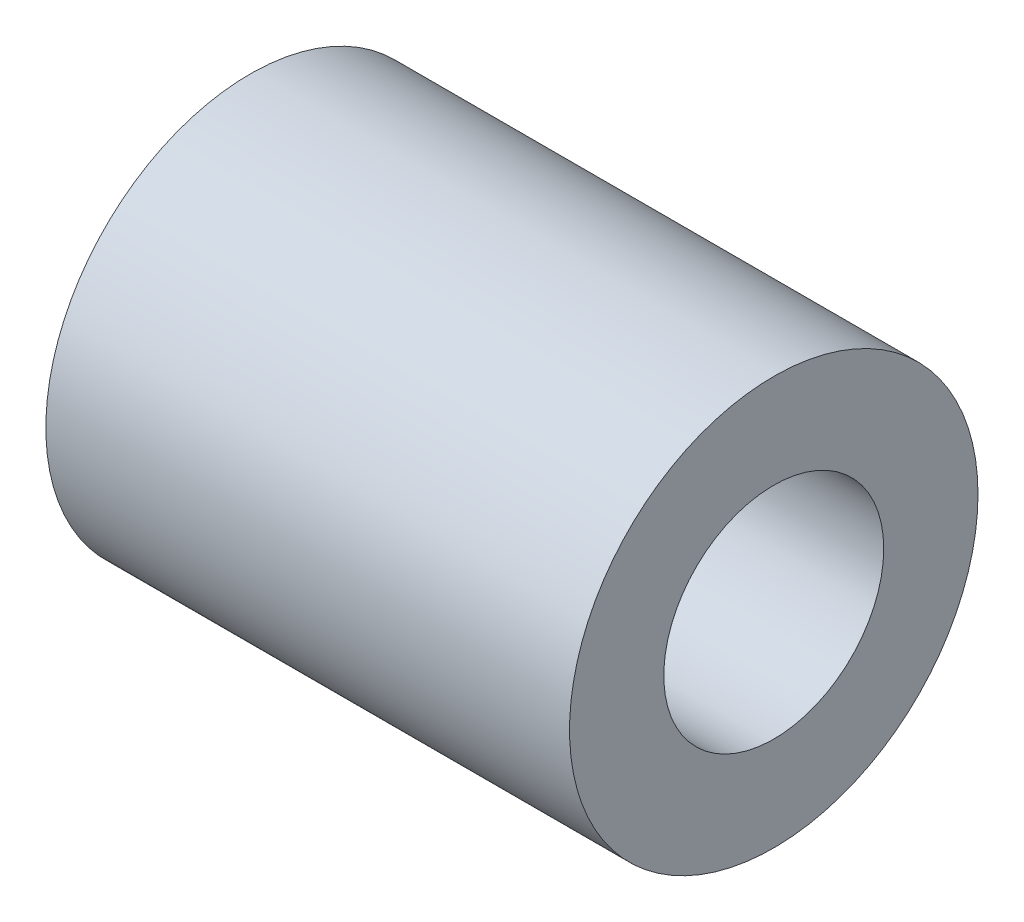
from build123d import *

# Parameters (mm, degrees)
SKETCH1_R           = 5.85
SKETCH1_R_2         = 3.15
BOSS_EXTRUDE1_DEPTH = 15


with BuildPart() as part:
    # Sketch1 → Boss-Extrude1 (new body)
    with BuildSketch(Plane(origin=(0, 0, 0), x_dir=(0, 0, -1), z_dir=(1, 0, 0))):
        Circle(SKETCH1_R)
        Circle(SKETCH1_R_2, mode=Mode.SUBTRACT)
    extrude(amount=BOSS_EXTRUDE1_DEPTH)


solid = part.part
